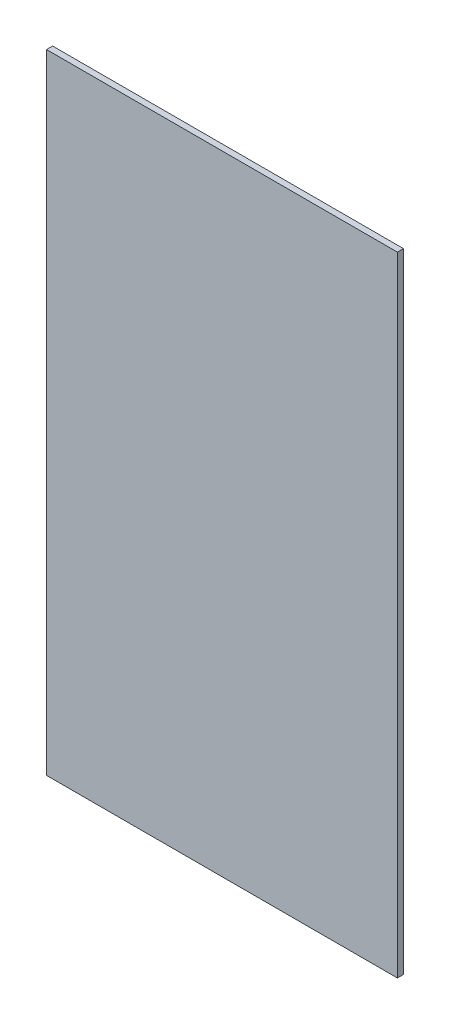
from build123d import *

# Parameters (mm, degrees)
SKETCH1_W           = 206
SKETCH1_H           = 115
BOSS_EXTRUDE1_DEPTH = 2


with BuildPart() as part:
    # Sketch1 → Boss-Extrude1 (new body)
    with BuildSketch(Plane(origin=(0, 0, 0), x_dir=(0, 1, 0), z_dir=(0, 0, 1))):
        Rectangle(SKETCH1_W, SKETCH1_H)
    extrude(amount=BOSS_EXTRUDE1_DEPTH)


solid = part.part
